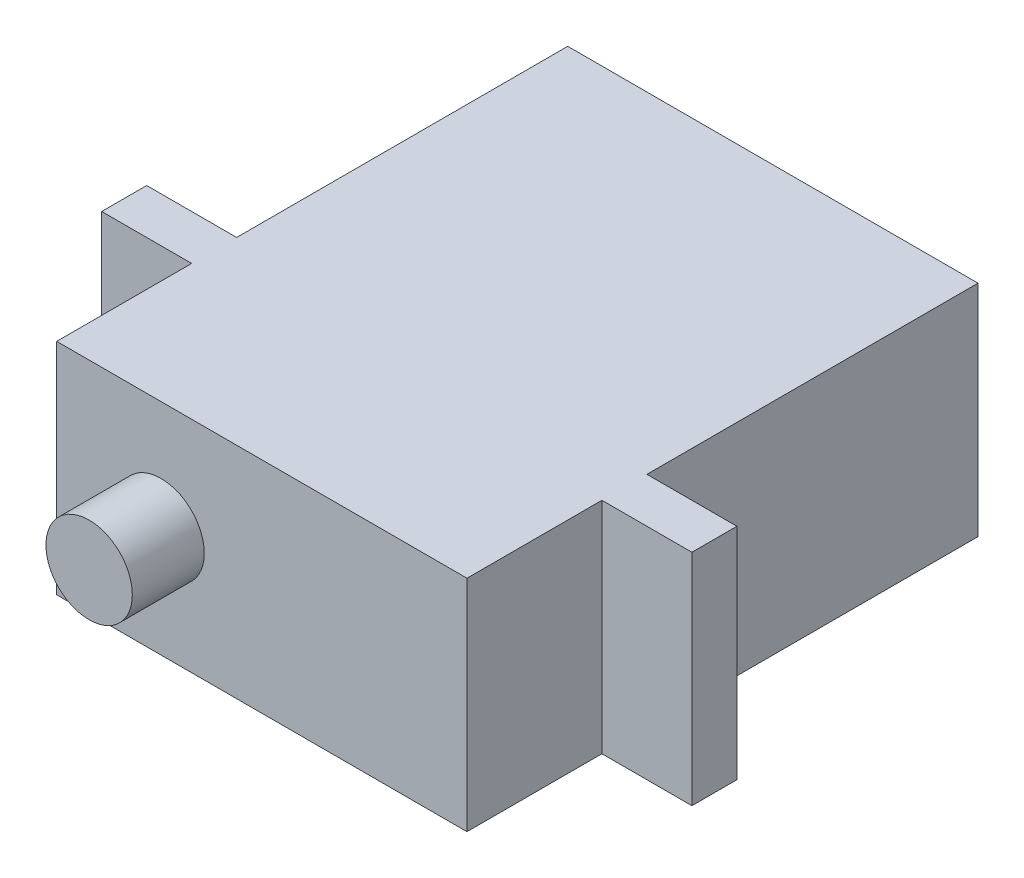
from build123d import *

# Parameters (mm, degrees)
S_BOX1_W     = 22.8
S_BOX1_H     = 12.2
BOSS_1_DEPTH = 28.4
S_BOX2_W     = 32.8
S_BOX2_H     = 12.2
BOSS_2_DEPTH = 2.5
S_CYL3_R     = 2.4
BOSS_3_DEPTH = 4.5


with BuildPart() as part:
    # S_box1 → Boss_1 (new body)
    with BuildSketch(Plane.XY.offset(-32.4)):
        with Locations((5.6, 0)):
            Rectangle(S_BOX1_W, S_BOX1_H)
    extrude(amount=BOSS_1_DEPTH)

    # S_box2 → Boss_2 (add)
    with BuildSketch(Plane.XY.offset(-14)):
        with Locations((5.6, 0)):
            Rectangle(S_BOX2_W, S_BOX2_H)
    extrude(amount=BOSS_2_DEPTH)

    # S_cyl3 → Boss_3 (add)
    with BuildSketch(Plane.XY.offset(-4.5)):
        Circle(S_CYL3_R)
    extrude(amount=BOSS_3_DEPTH)


solid = part.part
